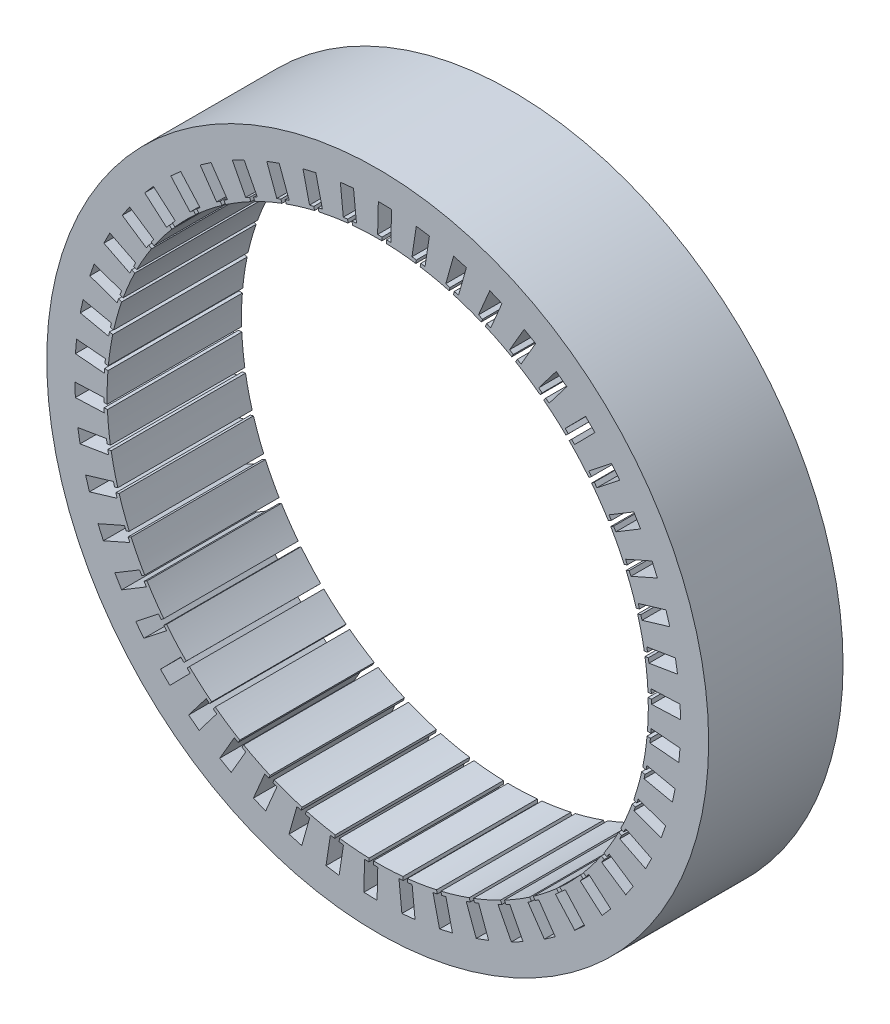
from build123d import *

# Parameters (mm, degrees)
ROTOR_STACK_START    = -15
SKETCH_1_R           = 73.876923077
SKETCH_1_R_2         = 60.4
ROTOR_STACK_DEPTH    = 30
ROTOR_50_SLOTS_DEPTH = 16


with BuildPart() as part:
    # Эскиз1 → Rotor_stack (new body)
    with BuildSketch(Plane.XY.offset(ROTOR_STACK_START)):
        Circle(SKETCH_1_R)
        Circle(SKETCH_1_R_2, mode=Mode.SUBTRACT)
    extrude(amount=ROTOR_STACK_DEPTH)

    # Эскиз2 → Rotor_50_slots (cut, symmetric)
    with BuildSketch(Plane.XY):
        Polygon((59.572159905, 1.821473104), (61.111550006, 1.881471551), (61.149597151, 0.905289646), (67.606233377, 1.156940055), (67.49119319, 4.108545187), (61.034556964, 3.856894778), (61.072604109, 2.880712872), (59.533214008, 2.820714424), align=None)
        Polygon((58.874124517, 9.273481675), (60.393856267, 9.525943756), (60.553951434, 8.562227908), (66.928134996, 9.621125076), (66.44406772, 12.535037561), (60.069884158, 11.476140394), (60.229979325, 10.512424546), (58.710247574, 10.259962465), align=None)
        Polygon((57.247609015, 16.579241902), (58.723715338, 17.020186138), (59.00333373, 16.084134722), (65.194539945, 17.933579206), (64.349079609, 20.763844904), (58.157873395, 18.91440042), (58.437491787, 17.978349005), (56.961385464, 17.537404768), align=None)
        Polygon((54.718264522, 23.623537579), (56.127466338, 24.246010017), (56.522198207, 23.352385123), (62.432788053, 25.96321008), (61.239268073, 28.66519401), (55.328678227, 26.054369053), (55.723410095, 25.16074416), (54.314208278, 24.538271722), align=None)
        Polygon((51.325980309, 30.295275957), (52.646053665, 31.089459834), (53.149673853, 30.252354461), (58.686433799, 33.583385621), (57.163676697, 36.114475882), (51.626916751, 32.783444722), (52.130536938, 31.946339349), (50.810463582, 31.152155472), align=None)
        Polygon((47.124254727, 36.489239735), (48.334381277, 37.442610297), (48.938947392, 36.675226097), (54.014559426, 40.673931109), (52.186579992, 42.994210896), (47.110967958, 38.995505884), (47.715534073, 38.228121684), (46.505407523, 37.274751121), align=None)
        Polygon((42.179351497, 42.107746405), (43.260446822, 43.205268429), (43.956424496, 42.519707509), (48.490843184, 47.123024405), (46.386469745, 49.19590152), (41.852051057, 44.592584623), (42.548028731, 43.907023703), (41.466933406, 42.809501678), align=None)
        Polygon((36.569254697, 47.06218876), (37.504269278, 48.286553669), (38.280682527, 47.693627733), (42.202397378, 52.828959458), (39.854817161, 54.621743389), (35.93310231, 49.486411665), (36.709515559, 48.893485729), (35.774500978, 47.669120821), align=None)
        Polygon((30.382438905, 51.274432285), (31.156627004, 52.606331112), (32.001231327, 52.115390957), (35.248394554, 57.70175026), (32.694630301, 59.186167736), (29.447467074, 53.599808432), (30.292071398, 53.108868278), (29.517883298, 51.776969452), align=None)
        Polygon((23.716473902, 54.678047383), (24.31762611, 56.096475287), (25.217101593, 55.715263334), (27.738503493, 61.664549992), (25.018829591, 62.817190861), (22.497427692, 56.867904202), (23.396903175, 56.486692248), (22.795750966, 55.068264344), align=None)
        Polygon((16.676485938, 57.219357011), (17.095121725, 58.701944538), (18.035283102, 58.436472725), (19.791159661, 64.654862934), (16.948466993, 65.457549361), (15.192590435, 59.239159151), (16.132751812, 58.973687338), (15.714116024, 57.491099812), align=None)
        Polygon((9.373499828, 58.858283198), (9.603017059, 60.381649055), (10.569037424, 60.236104032), (11.531697418, 66.625530065), (8.610816946, 67.065603205), (7.648156952, 60.676177173), (8.614177316, 60.53063215), (8.384660085, 59.007266292), align=None)
        Polygon((1.922688027, 59.568979098), (1.959467077, 61.109098897), (2.936111711, 61.085775996), (3.090373419, 67.545472786), (0.137369172, 67.615992424), (-0.016892536, 61.156295634), (0.959752098, 61.132972733), (0.922973048, 59.592852933), align=None)
        Polygon((-5.558445712, 59.340236613), (-5.714984871, 60.872821745), (-4.743118237, 60.972088782), (-5.399687616, 67.400183052), (-8.338244996, 67.10003705), (-7.681675618, 60.671942781), (-6.709808984, 60.771209818), (-6.553269826, 59.238624685), align=None)
        Polygon((-12.951919443, 58.175663148), (-13.299308094, 59.67654383), (-12.347546378, 59.896835305), (-13.804592351, 66.191952168), (-16.68236006, 65.525874009), (-15.225314086, 59.230757146), (-14.27355237, 59.45104862), (-13.926163719, 57.950167938), align=None)
        Polygon((-20.141133667, 56.093624723), (-20.673893283, 57.53913117), (-19.757246335, 57.876972954), (-21.991790418, 63.939834657), (-24.763384339, 62.918328791), (-22.528840257, 56.855467088), (-21.612193309, 57.193308872), (-21.079433692, 55.747802425), align=None)
        Polygon((-27.012710181, 53.126956328), (-27.722438826, 54.494292039), (-26.855362716, 54.944356166), (-29.832164813, 60.679347758), (-32.453875255, 59.318523942), (-29.477073158, 53.58353235), (-28.609997048, 54.033596476), (-27.900268403, 52.666260765), align=None)
        Polygon((-33.458280119, 49.322444095), (-34.333784947, 50.590045369), (-33.529953984, 51.145234058), (-37.202068148, 56.461911297), (-39.632549171, 54.783230536), (-35.960435007, 49.466553298), (-35.156604044, 50.021741987), (-34.281099215, 48.754140712), align=None)
        Polygon((-39.376192992, 44.740087455), (-40.40366677, 45.887963463), (-39.675757848, 46.539521057), (-43.985272645, 51.354036765), (-46.186194112, 49.383972858), (-41.876679314, 44.56945715), (-41.148770392, 45.221014745), (-40.121296614, 44.073138736), align=None)
        Polygon((-44.67311978, 39.452152909), (-45.836358632, 40.462200961), (-45.195851309, 41.199852008), (-50.074803117, 45.436278397), (-52.01145518, 43.205900428), (-47.132503373, 38.969474039), (-46.49199605, 39.707125086), (-45.328757197, 38.697077034), align=None)
        Polygon((-49.265524782, 33.542034344), (-50.546183738, 34.398325379), (-50.003179197, 35.210436681), (-55.37462403, 38.801962776), (-57.016464531, 36.346445138), (-51.645019698, 32.754919043), (-51.102015157, 33.567030345), (-49.821356202, 32.71073931), align=None)
        Polygon((-53.080983029, 27.10293786), (-54.45886533, 27.791967657), (-54.021927078, 28.665731734), (-59.801154044, 31.555717023), (-61.122290176, 28.913784696), (-55.34306321, 26.023799407), (-54.906124958, 26.897563483), (-53.528242657, 26.208533687), align=None)
        Polygon((-56.059322465, 20.236411856), (-57.512698085, 20.747314003), (-57.188716898, 21.668951073), (-63.284584134, 23.811818762), (-64.264180792, 21.025136597), (-58.168313556, 18.882268908), (-57.84433237, 19.803905978), (-56.39095675, 19.293003831), align=None)
        Polygon((-58.153572897, 13.050745548), (-59.659521234, 13.375462813), (-59.45360649, 14.330438109), (-65.769978529, 15.692393894), (-66.392586887, 12.804909534), (-60.076214849, 11.442953749), (-59.870300105, 12.397929045), (-58.364351768, 12.07321178), align=None)
        Polygon((-59.330706745, 5.659261187), (-60.865478094, 5.792672584), (-60.780877191, 6.765925576), (-67.218141072, 7.325490601), (-67.473942227, 4.382741398), (-61.036678346, 3.823176373), (-60.952077443, 4.796429365), (-59.417306094, 4.663017967), align=None)
        Polygon((-59.572159905, -1.821473104), (-61.111550006, -1.881471551), (-61.149597151, -0.905289646), (-67.606233377, -1.156940055), (-67.49119319, -4.108545187), (-61.034556964, -3.856894778), (-61.072604109, -2.880712872), (-59.533214008, -2.820714424), align=None)
        Polygon((-58.874124517, -9.273481675), (-60.393856267, -9.525943756), (-60.553951434, -8.562227908), (-66.928134996, -9.621125076), (-66.44406772, -12.535037561), (-60.069884158, -11.476140394), (-60.229979325, -10.512424546), (-58.710247574, -10.259962465), align=None)
        Polygon((-57.247609015, -16.579241902), (-58.723715338, -17.020186138), (-59.00333373, -16.084134722), (-65.194539945, -17.933579206), (-64.349079609, -20.763844904), (-58.157873395, -18.91440042), (-58.437491787, -17.978349005), (-56.961385464, -17.537404768), align=None)
        Polygon((-54.718264522, -23.623537579), (-56.127466338, -24.246010017), (-56.522198207, -23.352385123), (-62.432788053, -25.96321008), (-61.239268073, -28.66519401), (-55.328678227, -26.054369053), (-55.723410095, -25.16074416), (-54.314208278, -24.538271722), align=None)
        Polygon((-51.325980309, -30.295275957), (-52.646053665, -31.089459834), (-53.149673853, -30.252354461), (-58.686433799, -33.583385621), (-57.163676697, -36.114475882), (-51.626916751, -32.783444722), (-52.130536938, -31.946339349), (-50.810463582, -31.152155472), align=None)
        Polygon((-47.124254727, -36.489239735), (-48.334381277, -37.442610297), (-48.938947392, -36.675226097), (-54.014559426, -40.673931109), (-52.186579992, -42.994210896), (-47.110967958, -38.995505884), (-47.715534073, -38.228121684), (-46.505407523, -37.274751121), align=None)
        Polygon((-42.179351497, -42.107746405), (-43.260446822, -43.205268429), (-43.956424496, -42.519707509), (-48.490843184, -47.123024405), (-46.386469745, -49.19590152), (-41.852051057, -44.592584623), (-42.548028731, -43.907023703), (-41.466933406, -42.809501678), align=None)
        Polygon((-36.569254697, -47.06218876), (-37.504269278, -48.286553669), (-38.280682527, -47.693627733), (-42.202397378, -52.828959458), (-39.854817161, -54.621743389), (-35.93310231, -49.486411665), (-36.709515559, -48.893485729), (-35.774500978, -47.669120821), align=None)
        Polygon((-30.382438905, -51.274432285), (-31.156627004, -52.606331112), (-32.001231327, -52.115390957), (-35.248394554, -57.70175026), (-32.694630301, -59.186167736), (-29.447467074, -53.599808432), (-30.292071398, -53.108868278), (-29.517883298, -51.776969452), align=None)
        Polygon((-23.716473902, -54.678047383), (-24.31762611, -56.096475287), (-25.217101593, -55.715263334), (-27.738503493, -61.664549992), (-25.018829591, -62.817190861), (-22.497427692, -56.867904202), (-23.396903175, -56.486692248), (-22.795750966, -55.068264344), align=None)
        Polygon((-16.676485938, -57.219357011), (-17.095121725, -58.701944538), (-18.035283102, -58.436472725), (-19.791159661, -64.654862934), (-16.948466993, -65.457549361), (-15.192590435, -59.239159151), (-16.132751812, -58.973687338), (-15.714116024, -57.491099812), align=None)
        Polygon((-9.373499828, -58.858283198), (-9.603017059, -60.381649055), (-10.569037424, -60.236104032), (-11.531697418, -66.625530065), (-8.610816946, -67.065603205), (-7.648156952, -60.676177173), (-8.614177316, -60.53063215), (-8.384660085, -59.007266292), align=None)
        Polygon((-1.922688027, -59.568979098), (-1.959467077, -61.109098897), (-2.936111711, -61.085775996), (-3.090373419, -67.545472786), (-0.137369172, -67.615992424), (0.016892536, -61.156295634), (-0.959752098, -61.132972733), (-0.922973048, -59.592852933), align=None)
        Polygon((5.558445712, -59.340236613), (5.714984871, -60.872821745), (4.743118237, -60.972088782), (5.399687616, -67.400183052), (8.338244996, -67.10003705), (7.681675618, -60.671942781), (6.709808984, -60.771209818), (6.553269826, -59.238624685), align=None)
        Polygon((12.951919443, -58.175663148), (13.299308094, -59.67654383), (12.347546378, -59.896835305), (13.804592351, -66.191952168), (16.68236006, -65.525874009), (15.225314086, -59.230757146), (14.27355237, -59.45104862), (13.926163719, -57.950167938), align=None)
        Polygon((20.141133667, -56.093624723), (20.673893283, -57.53913117), (19.757246335, -57.876972954), (21.991790418, -63.939834657), (24.763384339, -62.918328791), (22.528840257, -56.855467088), (21.612193309, -57.193308872), (21.079433692, -55.747802425), align=None)
        Polygon((27.012710181, -53.126956328), (27.722438826, -54.494292039), (26.855362716, -54.944356166), (29.832164813, -60.679347758), (32.453875255, -59.318523942), (29.477073158, -53.58353235), (28.609997048, -54.033596476), (27.900268403, -52.666260765), align=None)
        Polygon((33.458280119, -49.322444095), (34.333784947, -50.590045369), (33.529953984, -51.145234058), (37.202068148, -56.461911297), (39.632549171, -54.783230536), (35.960435007, -49.466553298), (35.156604044, -50.021741987), (34.281099215, -48.754140712), align=None)
        Polygon((39.376192992, -44.740087455), (40.40366677, -45.887963463), (39.675757848, -46.539521057), (43.985272645, -51.354036765), (46.186194112, -49.383972858), (41.876679314, -44.56945715), (41.148770392, -45.221014745), (40.121296614, -44.073138736), align=None)
        Polygon((44.67311978, -39.452152909), (45.836358632, -40.462200961), (45.195851309, -41.199852008), (50.074803117, -45.436278397), (52.01145518, -43.205900428), (47.132503373, -38.969474039), (46.49199605, -39.707125086), (45.328757197, -38.697077034), align=None)
        Polygon((49.265524782, -33.542034344), (50.546183738, -34.398325379), (50.003179197, -35.210436681), (55.37462403, -38.801962776), (57.016464531, -36.346445138), (51.645019698, -32.754919043), (51.102015157, -33.567030345), (49.821356202, -32.71073931), align=None)
        Polygon((53.080983029, -27.10293786), (54.45886533, -27.791967657), (54.021927078, -28.665731734), (59.801154044, -31.555717023), (61.122290176, -28.913784696), (55.34306321, -26.023799407), (54.906124958, -26.897563483), (53.528242657, -26.208533687), align=None)
        Polygon((56.059322465, -20.236411856), (57.512698085, -20.747314003), (57.188716898, -21.668951073), (63.284584134, -23.811818762), (64.264180792, -21.025136597), (58.168313556, -18.882268908), (57.84433237, -19.803905978), (56.39095675, -19.293003831), align=None)
        Polygon((58.153572897, -13.050745548), (59.659521234, -13.375462813), (59.45360649, -14.330438109), (65.769978529, -15.692393894), (66.392586887, -12.804909534), (60.076214849, -11.442953749), (59.870300105, -12.397929045), (58.364351768, -12.07321178), align=None)
        Polygon((59.330706745, -5.659261187), (60.865478094, -5.792672584), (60.780877191, -6.765925576), (67.218141072, -7.325490601), (67.473942227, -4.382741398), (61.036678346, -3.823176373), (60.952077443, -4.796429365), (59.417306094, -4.663017967), align=None)
    extrude(amount=ROTOR_50_SLOTS_DEPTH, both=True, mode=Mode.SUBTRACT)


solid = part.part
